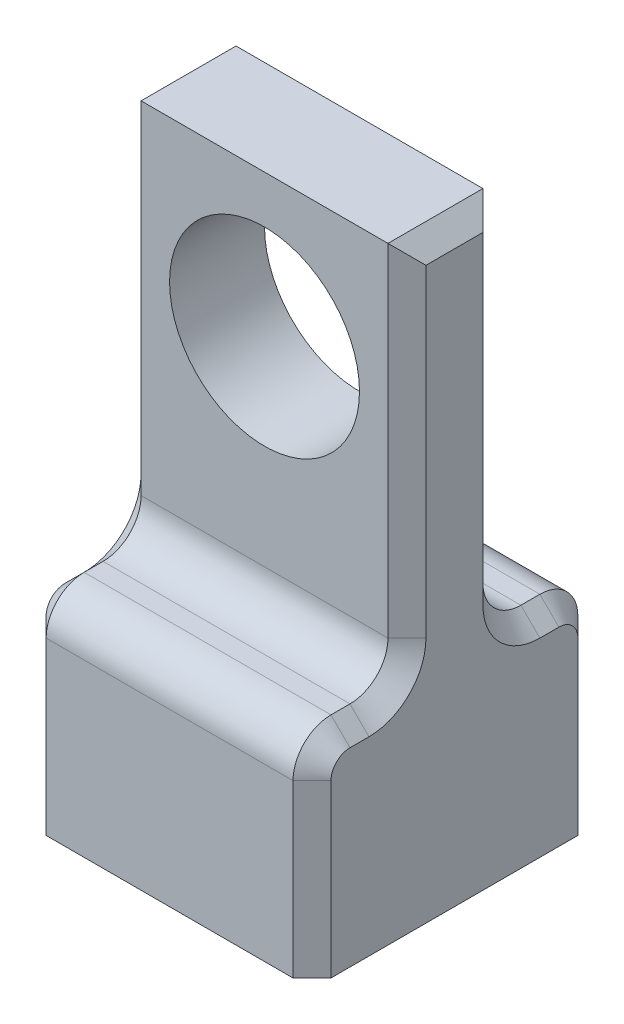
from build123d import *

# Parameters (mm, degrees)
SKETCH1_W           = 15
SKETCH1_H           = 15
BOSS_EXTRUDE1_DEPTH = 31
SKETCH2_R           = 5
CUT_EXTRUDE1_DEPTH  = 25
SKETCH3_W           = 15
SKETCH3_H           = 5
CUT_EXTRUDE2_DEPTH  = 20
FILLET4_R           = 2
CHAMFER1_SIZE       = 1
SKETCH4_R           = 1.5
CUT_EXTRUDE3_DEPTH  = 10


with BuildPart() as part:
    # Sketch1 → Boss-Extrude1 (new body)
    with BuildSketch(Plane(origin=(0, 0, 0), x_dir=(1, 0, 0), z_dir=(0, 1, 0))):
        Rectangle(SKETCH1_W, SKETCH1_H)
    extrude(amount=BOSS_EXTRUDE1_DEPTH)

    # Sketch2 → Cut-Extrude1 (cut)
    with BuildSketch(Plane.XY.offset(7.5)):
        with Locations((0, 23.5)):
            Circle(SKETCH2_R)
    extrude(amount=-CUT_EXTRUDE1_DEPTH, mode=Mode.SUBTRACT)

    # Sketch3 → Cut-Extrude2 (cut)
    with BuildSketch(Plane(origin=(0, 31, 0), x_dir=(1, 0, 0), z_dir=(0, 1, 0))):
        with Locations((0, 5)):
            Rectangle(SKETCH3_W, SKETCH3_H)
        with Locations((0, -5)):
            Rectangle(SKETCH3_W, SKETCH3_H)
    extrude(amount=-CUT_EXTRUDE2_DEPTH, mode=Mode.SUBTRACT)

    # Fillet4
    fillet4_edges = [part.edges().sort_by_distance(p)[0] for p in [
        (0, 11, -7.5),
        (0, 11, -2.5),
        (0, 11, 7.5),
        (0, 11, 2.5),
    ]]
    fillet(fillet4_edges, radius=FILLET4_R)

    # Chamfer1
    chamfer1_edges = [part.edges().sort_by_distance(p)[0] for p in [
        (-7.5, 31, 0),
        (7.5, 31, 0),
        (7.5, 11, 5),
        (-7.5, 11, 5),
        (7.5, 11, -5),
        (7.5, 22, -2.5),
        (7.5, 22, 2.5),
        (7.5, 4.5, 7.5),
        (7.5, 4.5, -7.5),
        (7.5, 10.414213562, -6.914213562),
        (7.5, 10.414213562, 6.914213562),
        (-7.5, 4.5, 7.5),
        (-7.5, 11, -5),
        (-7.5, 4.5, -7.5),
        (-7.5, 22, 2.5),
        (-7.5, 22, -2.5),
        (-7.5, 10.414213562, -6.914213562),
        (-7.5, 10.414213562, 6.914213562),
        (7.5, 11.585786438, -3.085786438),
        (-7.5, 11.585786438, -3.085786438),
        (-7.5, 11.585786438, 3.085786438),
        (7.5, 11.585786438, 3.085786438),
    ]]
    chamfer(chamfer1_edges, length=CHAMFER1_SIZE)

    # Sketch4 → Cut-Extrude3 (cut)
    with BuildSketch(Plane.XZ):
        with Locations(Location((0, 4, 0), (0, 0, 270))):
            Circle(SKETCH4_R)
        with Locations(Location((0, -4, 0), (0, 0, 270))):
            Circle(SKETCH4_R)
    extrude(amount=-CUT_EXTRUDE3_DEPTH, mode=Mode.SUBTRACT)


solid = part.part
